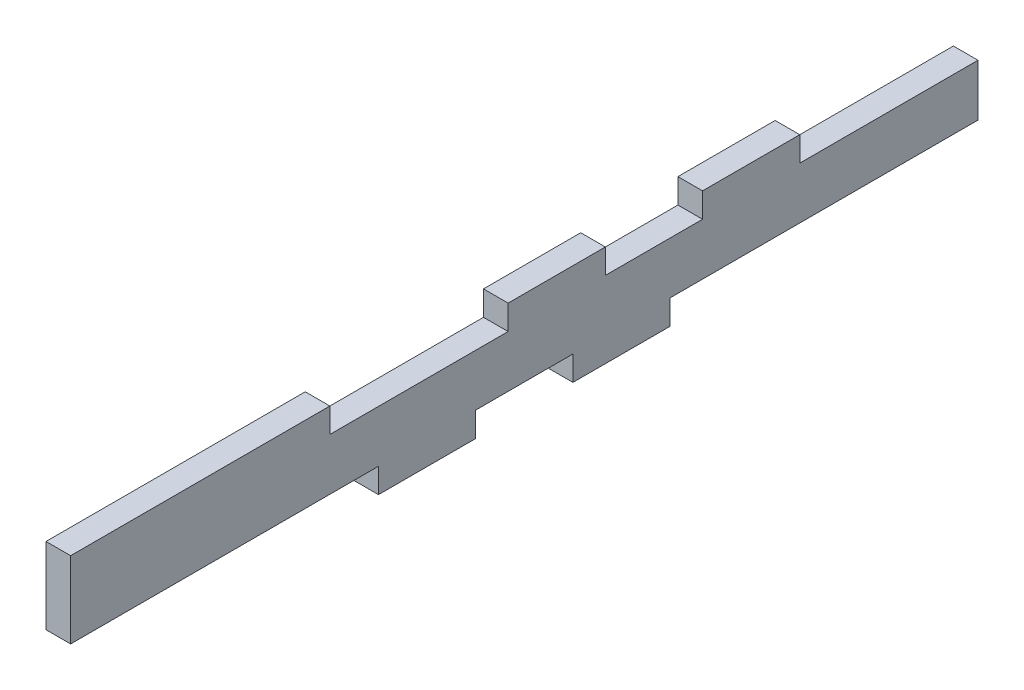
from build123d import *

# Parameters (mm, degrees)
SKETCH1_W          = 177.8
SKETCH1_H          = 19.812
BASE_DEPTH         = 4.826
SKETCH2_W          = 34.925
SKETCH2_H          = 4.826
SKETCH2_W_2        = 19.05
TOP_TABS_DEPTH     = 179.965487231
SKETCH3_W          = 60.325
SKETCH3_H          = 4.826
SKETCH3_W_2        = 19.05
CUT_EXTRUDE2_DEPTH = 179.965487231


with BuildPart() as part:
    # Sketch1 → Base (new body)
    with BuildSketch(Plane(origin=(0, 0, 0), x_dir=(0, 0, -1), z_dir=(1, 0, 0))):
        with Locations((88.9, 9.906)):
            Rectangle(SKETCH1_W, SKETCH1_H)
    extrude(amount=BASE_DEPTH)

    # Sketch2 → Top Tabs (cut, through all)
    with BuildSketch(Plane(origin=(4.826, 0, 0), x_dir=(0, 0, -1), z_dir=(1, 0, 0))):
        with Locations((68.2625, 17.399)):
            Rectangle(SKETCH2_W, SKETCH2_H)
        with Locations((114.3, 17.399)):
            Rectangle(SKETCH2_W_2, SKETCH2_H)
        with Locations((160.3375, 17.399)):
            Rectangle(SKETCH2_W, SKETCH2_H)
    extrude(amount=-TOP_TABS_DEPTH, mode=Mode.SUBTRACT)

    # Sketch3 → Cut-Extrude2 (cut, through all)
    with BuildSketch(Plane(origin=(4.826, 0, 0), x_dir=(0, 0, -1), z_dir=(1, 0, 0))):
        with Locations((30.1625, 2.413)):
            Rectangle(SKETCH3_W, SKETCH3_H)
        with Locations((147.6375, 2.413)):
            Rectangle(SKETCH3_W, SKETCH3_H)
        with Locations((88.9, 2.413)):
            Rectangle(SKETCH3_W_2, SKETCH3_H)
    extrude(amount=-CUT_EXTRUDE2_DEPTH, mode=Mode.SUBTRACT)


solid = part.part
